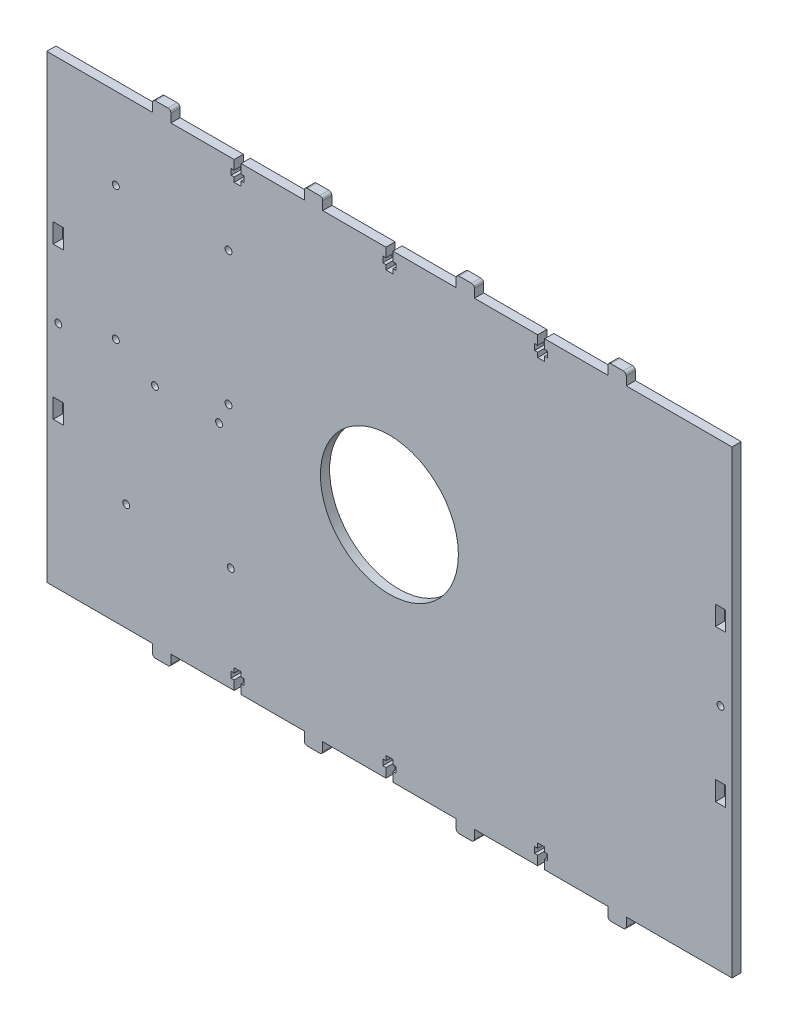
from build123d import *

# Parameters (mm, degrees)
SKETCH_1_R          = 1.5
SKETCH_1_R_2        = 30
SKETCH_1_W          = 4.4
SKETCH_1_H          = 8.4
EXTRUDE_1_DEPTH     = 4
SKETCH_4_R          = 1.5
CUT_EXTRUDE_1_DEPTH = 10
FILLET_1_R          = 1.3


with BuildPart() as part:
    # 草图1 → 凸台-拉伸1 (new body)
    with BuildSketch(Plane.XY):
        Polygon((0, 0), (0, -4), (-1.35, -4), (-1.35, -6.6), (0, -6.6), (0, -8.6), (3, -8.6), (3, -6.6), (4.35, -6.6), (4.35, -4), (3, -4), (3, 0), (30.5, 0), (30.5, 5), (38.5, 5), (38.5, 0), (66, 0), (66, -4), (64.65, -4), (64.65, -6.6), (66, -6.6), (66, -8.6), (69, -8.6), (69, -6.6), (70.35, -6.6), (70.35, -4), (69, -4), (69, 0), (96.5, 0), (96.5, 5), (104.5, 5), (104.5, 0), (132, 0), (143.5, 0), (145.5, 0), (150.5, 0), (150.5, -200), (145.5, -200), (143.5, -200), (132, -200), (104.5, -200), (104.5, -205), (96.5, -205), (96.5, -200), (69, -200), (69, -196), (70.35, -196), (70.35, -193.4), (69, -193.4), (69, -191.4), (66, -191.4), (66, -193.4), (64.65, -193.4), (64.65, -196), (66, -196), (66, -200), (38.5, -200), (38.5, -205), (30.5, -205), (30.5, -200), (3, -200), (3, -196), (4.35, -196), (4.35, -193.4), (3, -193.4), (3, -191.4), (0, -191.4), (0, -193.4), (-1.35, -193.4), (-1.35, -196), (0, -196), (0, -200), (-27.5, -200), (-27.5, -205), (-35.5, -205), (-35.5, -200), (-63, -200), (-63, -196), (-61.65, -196), (-61.65, -193.4), (-63, -193.4), (-63, -191.4), (-66, -191.4), (-66, -193.4), (-67.35, -193.4), (-67.35, -196), (-66, -196), (-66, -200), (-93.5, -200), (-93.5, -205), (-101.5, -205), (-101.5, -200), (-129, -200), (-140.5, -200), (-142.5, -200), (-147.5, -200), (-147.5, 0), (-142.5, 0), (-140.5, 0), (-129, 0), (-101.5, 0), (-101.5, 5), (-93.5, 5), (-93.5, 0), (-66, 0), (-66, -4), (-67.35, -4), (-67.35, -6.6), (-66, -6.6), (-66, -8.6), (-63, -8.6), (-63, -6.6), (-61.65, -6.6), (-61.65, -4), (-63, -4), (-63, 0), (-35.5, 0), (-35.5, 5), (-27.5, 5), (-27.5, 0), align=None)
        with Locations((-142.5, -100)):
            Circle(SKETCH_1_R, mode=Mode.SUBTRACT)
        with Locations(Location((145.5, -100, 0), (0, 0, 180))):
            Circle(SKETCH_1_R, mode=Mode.SUBTRACT)
        with Locations((1.5, -100)):
            Circle(SKETCH_1_R_2, mode=Mode.SUBTRACT)
        with Locations((-142.5, -67)):
            Rectangle(SKETCH_1_W, SKETCH_1_H, mode=Mode.SUBTRACT)
        with Locations((-142.5, -133)):
            Rectangle(SKETCH_1_W, SKETCH_1_H, mode=Mode.SUBTRACT)
        with Locations((145.5, -133)):
            Rectangle(SKETCH_1_W, SKETCH_1_H, mode=Mode.SUBTRACT)
        with Locations((145.5, -67)):
            Rectangle(SKETCH_1_W, SKETCH_1_H, mode=Mode.SUBTRACT)
    extrude(amount=EXTRUDE_1_DEPTH)

    # 草图4 → 切除-拉伸1 (cut)
    with BuildSketch(Plane.XY.offset(4)):
        with Locations((-100.464854909, -102.524202067)):
            Circle(SKETCH_4_R)
        with Locations((-72.564854909, -102.524202067)):
            Circle(SKETCH_4_R)
        with Locations((-112.964854909, -153.324202067)):
            Circle(SKETCH_4_R)
        with Locations((-67.464854909, -154.624202067)):
            Circle(SKETCH_4_R)
        with Locations((-117.464854909, -35.441983185)):
            Circle(SKETCH_4_R)
        with Locations((-68.464854909, -35.441983185)):
            Circle(SKETCH_4_R)
        with Locations((-117.464854909, -93.441983185)):
            Circle(SKETCH_4_R)
        with Locations((-68.464854909, -93.441983185)):
            Circle(SKETCH_4_R)
    extrude(amount=-CUT_EXTRUDE_1_DEPTH, mode=Mode.SUBTRACT)

    # 圆角1
    fillet_1_edges = [part.edges().sort_by_distance(p)[0] for p in [
        (30.5, 5, 2),
        (38.5, 5, 2),
        (96.5, 5, 2),
        (104.5, 5, 2),
        (104.5, -205, 2),
        (96.5, -205, 2),
        (38.5, -205, 2),
        (30.5, -205, 2),
        (-27.5, -205, 2),
        (-35.5, -205, 2),
        (-93.5, -205, 2),
        (-101.5, -205, 2),
        (-101.5, 5, 2),
        (-93.5, 5, 2),
        (-35.5, 5, 2),
        (-27.5, 5, 2),
    ]]
    fillet(fillet_1_edges, radius=FILLET_1_R)


solid = part.part
